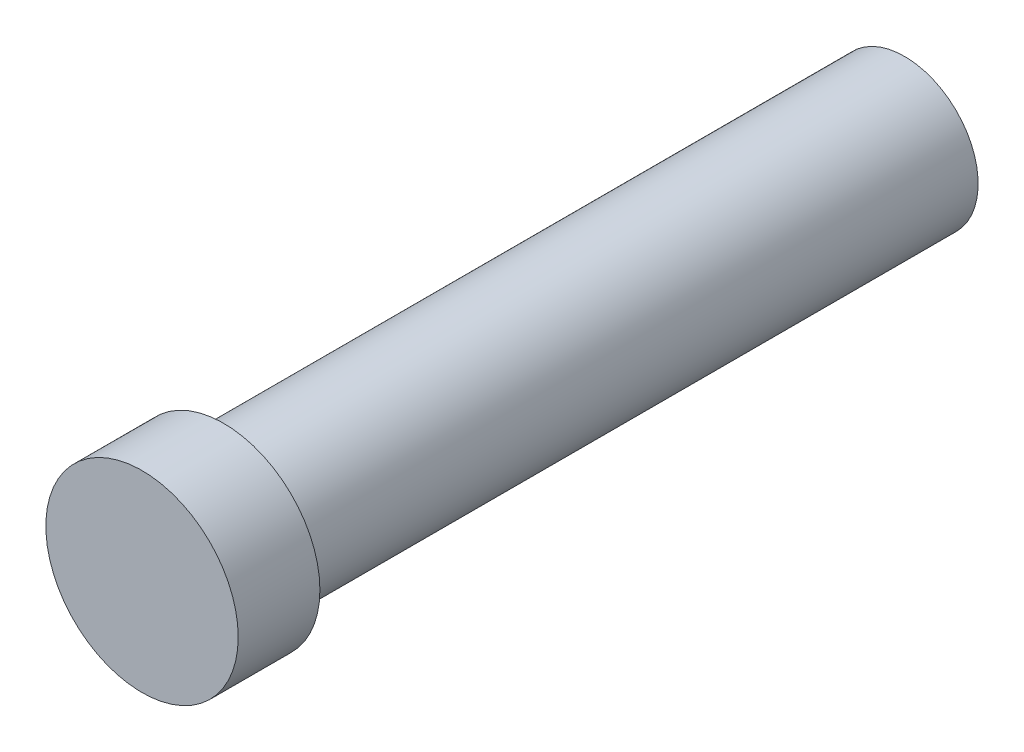
from build123d import *

# Parameters (mm, degrees)
SKETCH1_R           = 1.35
BOSS_EXTRUDE1_DEPTH = 14
SKETCH2_R           = 1.765747212
BOSS_EXTRUDE2_DEPTH = 1.5


with BuildPart() as part:
    # Sketch1 → Boss-Extrude1 (new body)
    with BuildSketch(Plane.XY):
        with Locations(Location((0, 0, 0), (0, 0, 180))):
            Circle(SKETCH1_R)
    extrude(amount=BOSS_EXTRUDE1_DEPTH)

    # Sketch2 → Boss-Extrude2 (add)
    with BuildSketch(Plane.XY.offset(14)):
        Circle(SKETCH2_R)
    extrude(amount=-BOSS_EXTRUDE2_DEPTH)


solid = part.part
